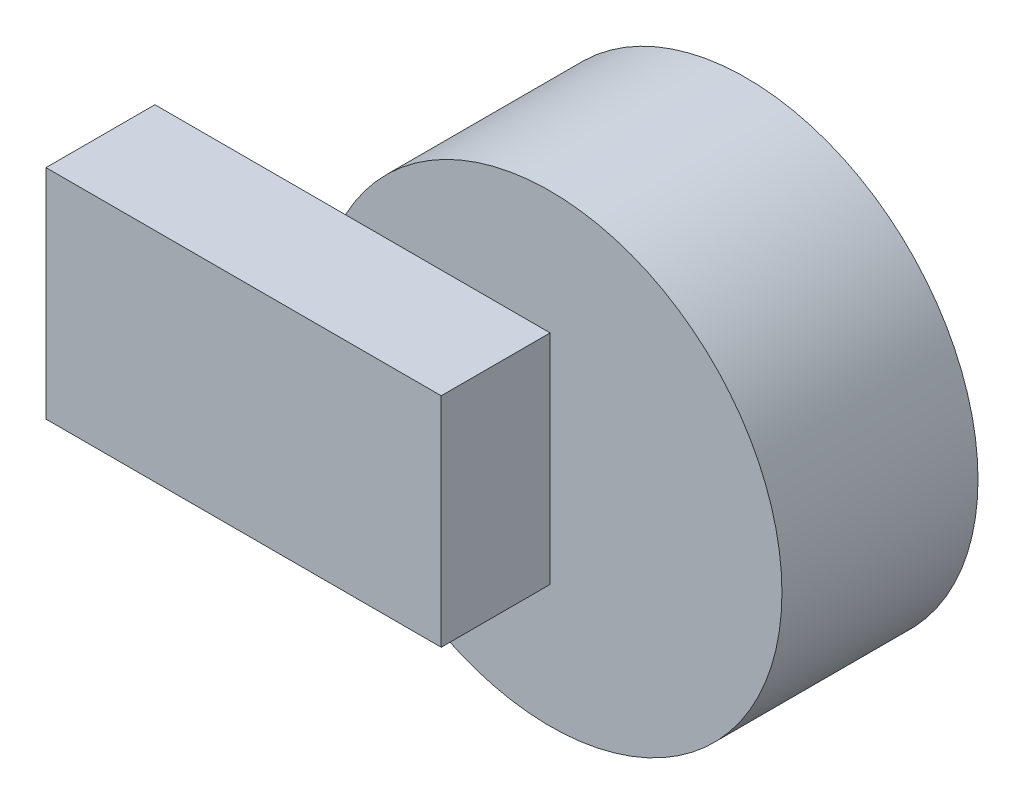
from build123d import *

# Parameters (mm, degrees)
SKETCH3_R           = 42.57
BOSS_EXTRUDE1_DEPTH = 36
SKETCH4_W           = 72.57
SKETCH4_H           = 40
BOSS_EXTRUDE2_DEPTH = 20


with BuildPart() as part:
    # Sketch3 → Boss-Extrude1 (new body)
    with BuildSketch(Plane.XY):
        Circle(SKETCH3_R)
    extrude(amount=BOSS_EXTRUDE1_DEPTH)

    # Sketch4 → Boss-Extrude2 (add)
    with BuildSketch(Plane.XY.offset(36)):
        with Locations((-36.285, 0)):
            Rectangle(SKETCH4_W, SKETCH4_H)
    extrude(amount=BOSS_EXTRUDE2_DEPTH)


solid = part.part
